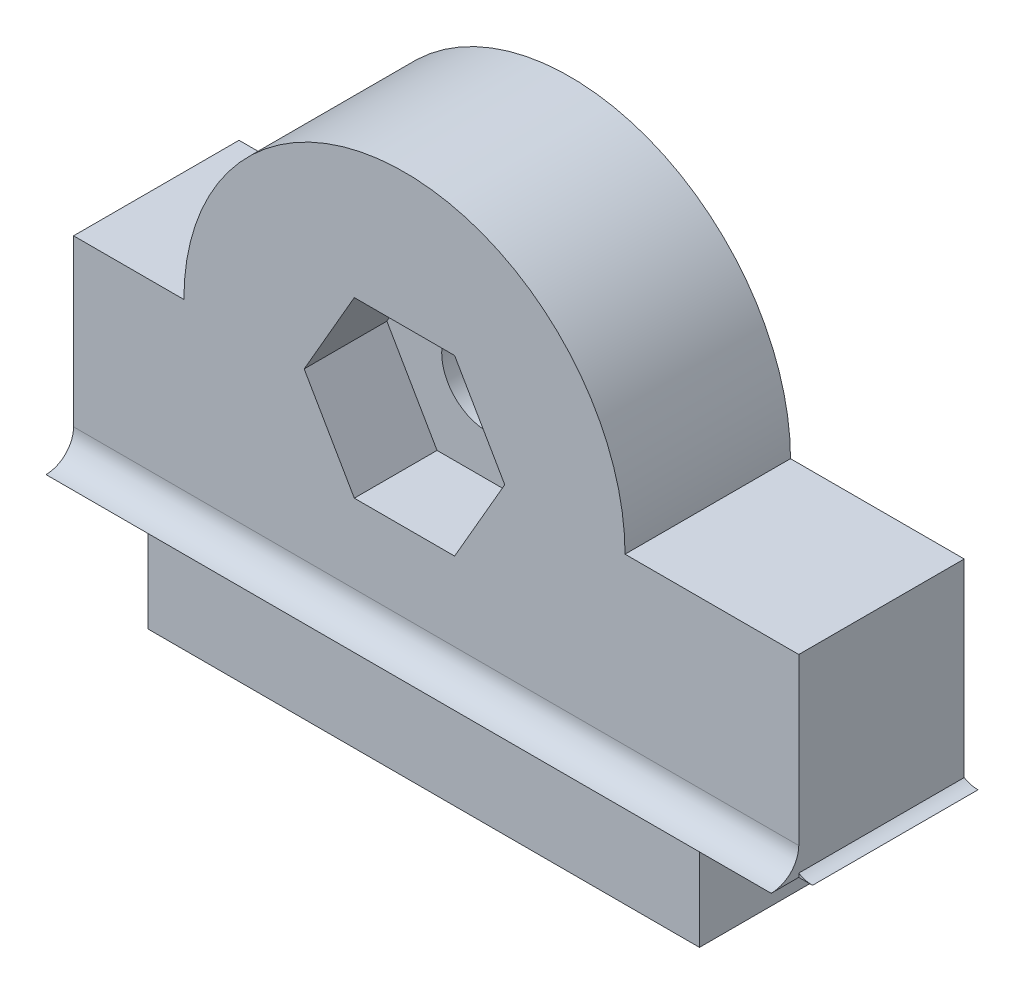
from build123d import *

# Parameters (mm, degrees)
BOSS_EXTRUDE1_DEPTH = 6
BOSS_EXTRUDE2_DEPTH = 26.3
BOSS_EXTRUDE3_DEPTH = 6
SKETCH8_R           = 1.65
BOSS_EXTRUDE4_DEPTH = 3
CUT_EXTRUDE1_DEPTH  = 10
SKETCH9_R           = 1.65
BOSS_EXTRUDE5_DEPTH = 3


with BuildPart() as part:
    # Sketch1 → Boss-Extrude1 (new body)
    with BuildSketch(Plane.XY):
        with BuildLine():
            Line((0, 0), (20, 0))
            Line((20, 0), (20, 4))
            Line((20, 4), (23.6, 4))
            Line((23.6, 4), (23.6, 11))
            Line((23.6, 11), (17.3, 11))
            ThreePointArc((17.3, 11), (9.3, 19), (1.3, 11))
            Line((1.3, 11), (-2.7, 11))
            Line((-2.7, 11), (-2.7, 4))
            Line((-2.7, 4), (0, 4))
            Line((0, 4), (0, 0))
        make_face()
        Polygon((11.118653348, 14.15), (7.481346652, 14.15), (5.662693304, 11), (7.481346652, 7.85), (11.118653348, 7.85), (12.937306696, 11), align=None, mode=Mode.SUBTRACT)
    extrude(amount=BOSS_EXTRUDE1_DEPTH)

    # Sketch2 → Boss-Extrude2 (add)
    with BuildSketch(Plane.ZY.offset(2.7)):
        with BuildLine():
            Line((6, 4), (6, 5))
            ThreePointArc((6, 5), (6.292893219, 4.292893219), (7, 4))
            Line((7, 4), (6, 4))
        make_face()
    extrude(amount=-BOSS_EXTRUDE2_DEPTH)

    # Sketch4 → Boss-Extrude3 (add)
    with BuildSketch(Plane.XY.offset(6)):
        with BuildLine():
            Line((23.1, 4), (23.1, 5))
            ThreePointArc((23.1, 5), (23.392893219, 4.292893219), (24.1, 4))
            Line((24.1, 4), (23.1, 4))
        make_face()
        with BuildLine():
            Line((-1.5, 4), (-2.5, 4))
            ThreePointArc((-2.5, 4), (-1.792893219, 4.292893219), (-1.5, 5))
            Line((-1.5, 5), (-1.5, 4))
        make_face()
    extrude(amount=-BOSS_EXTRUDE3_DEPTH)

    # Sketch8 → Boss-Extrude4 (add)
    with BuildSketch(Plane.XY.offset(6)):
        Polygon((7.481346652, 14.15), (5.662693304, 11), (7.481346652, 7.85), (11.118653348, 7.85), (12.937306696, 11), (11.118653348, 14.15), align=None)
        with Locations((9.3, 11)):
            Circle(SKETCH8_R, mode=Mode.SUBTRACT)
    extrude(amount=-BOSS_EXTRUDE4_DEPTH)

    # Sketch11 → Cut-Extrude1 (cut)
    with BuildSketch(Plane.XY.offset(6)):
        Polygon((7.481346652, 14.15), (5.662693304, 11), (7.481346652, 7.85), (11.118653348, 7.85), (12.937306696, 11), (11.118653348, 14.15), align=None)
    extrude(amount=-CUT_EXTRUDE1_DEPTH, mode=Mode.SUBTRACT)

    # Sketch9 → Boss-Extrude5 (add)
    with BuildSketch(Plane(origin=(0, 0, 0), x_dir=(-1, 0, 0), z_dir=(0, 0, -1))):
        Polygon((-11.118653348, 14.15), (-12.937306696, 11), (-11.118653348, 7.85), (-7.481346652, 7.85), (-5.662693304, 11), (-7.481346652, 14.15), align=None)
        with Locations((-9.3, 11)):
            Circle(SKETCH9_R, mode=Mode.SUBTRACT)
    extrude(amount=-BOSS_EXTRUDE5_DEPTH)


solid = part.part
